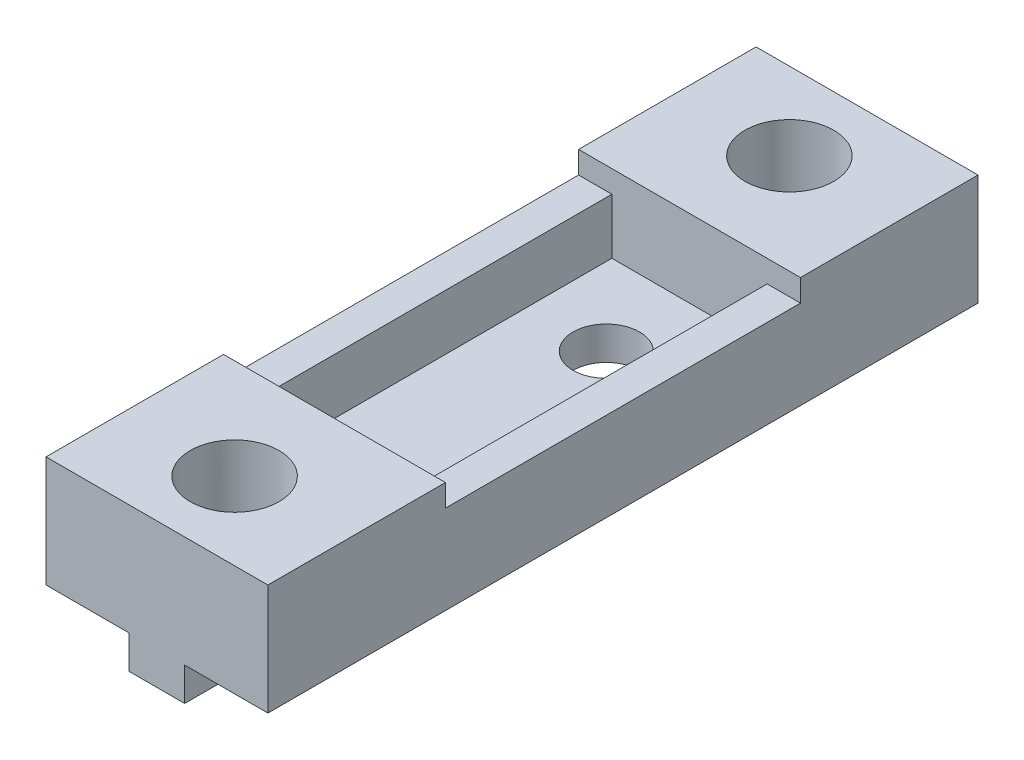
from build123d import *

# Parameters (mm, degrees)
SKETCH1_W               = 20
SKETCH1_H               = 30
BOSS_EXTRUDE1_DEPTH     = 3
SKETCH2_W               = 5
SKETCH2_H               = 12
BOSS_EXTRUDE2_DEPTH     = 3
SKETCH3_R               = 7
SKETCH3_R_2             = 4
BOSS_EXTRUDE3_DEPTH     = 7
SKETCH4_R               = 4
BOSS_EXTRUDE4_DEPTH     = 1
CUT_EXTRUDE1_DEPTH      = 20.339079606
CUT_EXTRUDE1_DEPTH_BACK = 20.339079606
SKETCH5_R               = 3
SKETCH6_R               = 7
SKETCH6_R_2             = 4
BOSS_EXTRUDE6_DEPTH     = 7
SKETCH7_W               = 20
SKETCH7_H               = 3
BOSS_EXTRUDE7_DEPTH     = 19
SKETCH8_W               = 5
SKETCH8_H               = 3
BOSS_EXTRUDE8_DEPTH     = 12
CUT_EXTRUDE2_START      = -1.5
SKETCH10_R              = 4
CUT_EXTRUDE2_DEPTH      = 1.5
SKETCH12_W              = 3
SKETCH12_H              = 32
BOSS_EXTRUDE9_DEPTH     = 5


with BuildPart() as part:
    # Sketch1 → Boss-Extrude1 (new body)
    with BuildSketch(Plane(origin=(0, 0, 0), x_dir=(1, 0, 0), z_dir=(0, 1, 0))):
        Rectangle(SKETCH1_W, SKETCH1_H)
    boss_extrude1 = extrude(amount=BOSS_EXTRUDE1_DEPTH)

    # Sketch2 → Boss-Extrude2 (add)
    with BuildSketch(Plane.XZ):
        with Locations((0, -9)):
            Rectangle(SKETCH2_W, SKETCH2_H)
    boss_extrude2 = extrude(amount=BOSS_EXTRUDE2_DEPTH)

    # Sketch3 → Boss-Extrude3 (add)
    with BuildSketch(Plane(origin=(0, 3, 0), x_dir=(1, 0, 0), z_dir=(0, 1, 0))):
        with Locations(Location((0, 8, 0), (0, 0, 90))):
            Circle(SKETCH3_R)
        with Locations(Location((0, 8, 0), (0, 0, 270))):
            Circle(SKETCH3_R_2, mode=Mode.SUBTRACT)
    boss_extrude3 = extrude(amount=BOSS_EXTRUDE3_DEPTH)

    # Sketch4 → Boss-Extrude4 (add)
    with BuildSketch(Plane(origin=(0, 3, 0), x_dir=(1, 0, 0), z_dir=(0, 1, 0))):
        with Locations(Location((0, 8, 0), (0, 0, 270))):
            Circle(SKETCH4_R)
    boss_extrude4 = extrude(amount=BOSS_EXTRUDE4_DEPTH)

    # Sketch5 → Cut-Extrude1 (cut, two sides: drawn at the far end of the back side and taken through both)
    with BuildSketch(Plane(origin=(0, 3, 0), x_dir=(1, 0, 0), z_dir=(0, 1, 0)).offset(-CUT_EXTRUDE1_DEPTH_BACK)):
        with Locations(Location((0, -8.5, 0), (0, 0, 90))):
            Circle(SKETCH5_R)
    extrude(amount=CUT_EXTRUDE1_DEPTH + CUT_EXTRUDE1_DEPTH_BACK, mode=Mode.SUBTRACT)

    # Sketch6 → Boss-Extrude6 (add)
    # profile 1 of 2: a face of its own
    with BuildSketch(Plane(origin=(0, 3, 0), x_dir=(1, 0, 0), z_dir=(0, 1, 0))):
        Polygon((0, 15), (-10, 15), (-10, -1), (10, -1), (10, 15), align=None)
        with BuildLine():
            ThreePointArc((7, 8), (-4.949747468, 3.050252532), (0, 15))
            ThreePointArc((0, 15), (4.949747468, 12.949747468), (7, 8))
        make_face(mode=Mode.SUBTRACT)
    # profile 2 of 2: a face of its own
    with BuildSketch(Plane(origin=(0, 3, 0), x_dir=(1, 0, 0), z_dir=(0, 1, 0))):
        with Locations((0, 8)):
            Circle(SKETCH6_R)
        with Locations(Location((0, 8, 0), (0, 0, 270))):
            Circle(SKETCH6_R_2, mode=Mode.SUBTRACT)
    boss_extrude6 = extrude(amount=BOSS_EXTRUDE6_DEPTH)

    # Sketch7 → Boss-Extrude7 (add)
    with BuildSketch(Plane.XY.offset(15)):
        with Locations((0, 1.5)):
            Rectangle(SKETCH7_W, SKETCH7_H)
    extrude(amount=BOSS_EXTRUDE7_DEPTH)

    # Mirror3: Boss-Extrude1, Boss-Extrude2, Boss-Extrude3, Boss-Extrude4, Boss-Extrude6 across plane
    add(boss_extrude1.mirror(Plane.XY.offset(17)))
    add(boss_extrude2.mirror(Plane.XY.offset(17)))
    add(boss_extrude3.mirror(Plane.XY.offset(17)))
    add(boss_extrude4.mirror(Plane.XY.offset(17)))
    add(boss_extrude6.mirror(Plane.XY.offset(17)))

    # Sketch8 → Boss-Extrude8 (add)
    with BuildSketch(Plane(origin=(0, 0, 37), x_dir=(-1, 0, 0), z_dir=(0, 0, -1))):
        with Locations((0, -1.5)):
            Rectangle(SKETCH8_W, SKETCH8_H)
    extrude(amount=BOSS_EXTRUDE8_DEPTH)

    # Sketch10 → Cut-Extrude2 (cut)
    with BuildSketch(Plane(origin=(0, 4, 0), x_dir=(1, 0, 0), z_dir=(0, 1, 0)).offset(CUT_EXTRUDE2_START)):
        with Locations(Location((0, 8, 0), (0, 0, 270))):
            Circle(SKETCH10_R)
        with Locations(Location((0, -42, 0), (0, 0, 90))):
            Circle(SKETCH10_R)
    extrude(amount=CUT_EXTRUDE2_DEPTH, mode=Mode.SUBTRACT)

    # Sketch12 → Boss-Extrude9 (add)
    with BuildSketch(Plane(origin=(0, 3, 0), x_dir=(1, 0, 0), z_dir=(0, 1, 0))):
        with Locations((8.5, -17)):
            Rectangle(SKETCH12_W, SKETCH12_H)
        with Locations((-8.5, -17)):
            Rectangle(SKETCH12_W, SKETCH12_H)
    extrude(amount=BOSS_EXTRUDE9_DEPTH)


solid = part.part
